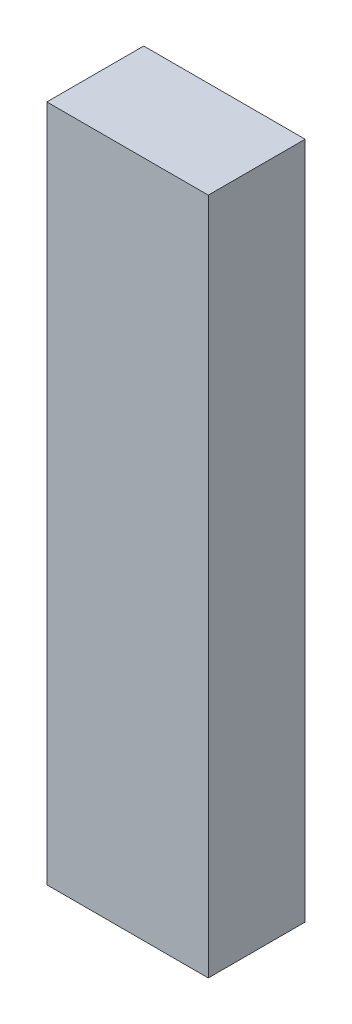
from build123d import *

# Parameters (mm, degrees)
SKETCH1_W           = 12.7
SKETCH1_H           = 53.34
BOSS_EXTRUDE1_DEPTH = 7.62


with BuildPart() as part:
    # Sketch1 → Boss-Extrude1 (new body)
    with BuildSketch(Plane.XY):
        with Locations((6.35, 26.67)):
            Rectangle(SKETCH1_W, SKETCH1_H)
    extrude(amount=BOSS_EXTRUDE1_DEPTH)


solid = part.part
